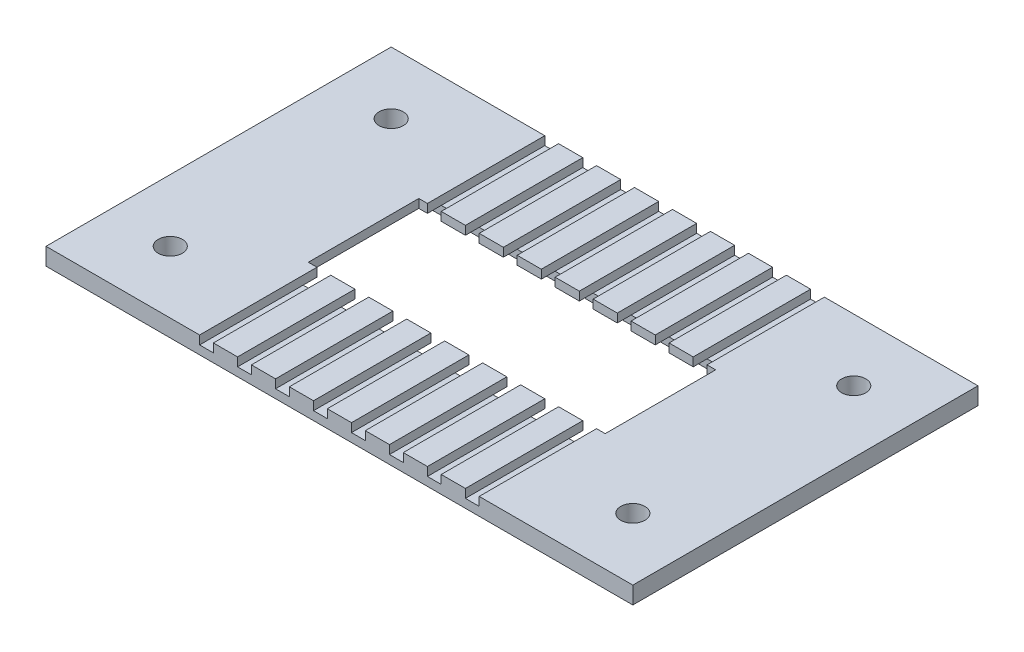
from build123d import *

# Parameters (mm, degrees)
SKETCH1_W           = 85
SKETCH1_H           = 50
BASE_PLATE_DEPTH    = 2.5
SKETCH7_R           = 1.75
SCRE_CUT_DEPTH      = 5
SKETCH13_W          = 43
SKETCH13_H          = 16
CUT_EXTRUDE1_DEPTH  = 10
SKETCH15_R          = 5
BOSS_EXTRUDE3_DEPTH = 4
SKETCH18_R          = 1.75
CUT_EXTRUDE4_DEPTH  = 4
M3_NUT_DEPTH        = 3
SKETCH21_W          = 47
SKETCH21_H          = 20
SKETCH21_W_2        = 43
SKETCH21_H_2        = 16
CUT_EXTRUDE7_DEPTH  = 1.25
CUT_EXTRUDE8_REACH  = 67.744
SKETCH20_W          = 2
SKETCH20_H          = 1.25


with BuildPart() as part:
    # Sketch1 → Base Plate (new body)
    with BuildSketch(Plane(origin=(0, 0, 0), x_dir=(1, 0, 0), z_dir=(0, 1, 0))):
        Rectangle(SKETCH1_W, SKETCH1_H)
    extrude(amount=BASE_PLATE_DEPTH)

    # Sketch7 → Scre Cut (cut)
    with BuildSketch(Plane(origin=(0, 2.5, 0), x_dir=(1, 0, 0), z_dir=(0, 1, 0))):
        with Locations(Location((-33.5, 16, 0), (0, 0, 270))):
            Circle(SKETCH7_R)
        with Locations(Location((-33.5, -16, 0), (0, 0, 270))):
            Circle(SKETCH7_R)
        with Locations(Location((33.5, -16, 0), (0, 0, 270))):
            Circle(SKETCH7_R)
        with Locations(Location((33.5, 16, 0), (0, 0, 270))):
            Circle(SKETCH7_R)
    extrude(amount=-SCRE_CUT_DEPTH, mode=Mode.SUBTRACT)

    # Sketch13 → Cut-Extrude1 (cut)
    with BuildSketch(Plane(origin=(0, 2.5, 0), x_dir=(1, 0, 0), z_dir=(0, 1, 0))):
        Rectangle(SKETCH13_W, SKETCH13_H)
    extrude(amount=-CUT_EXTRUDE1_DEPTH, mode=Mode.SUBTRACT)

    # Sketch15 → Boss-Extrude3 (add)
    with BuildSketch(Plane(origin=(-42.5, 0, -25), x_dir=(1, 0, 0), z_dir=(0, -1, 0))):
        with Locations(Location((9, 9, 0), (0, 0, 90))):
            Circle(SKETCH15_R)
        with Locations(Location((9, 41, 0), (0, 0, 90))):
            Circle(SKETCH15_R)
        with Locations(Location((76, 41, 0), (0, 0, 90))):
            Circle(SKETCH15_R)
        with Locations(Location((76, 9, 0), (0, 0, 90))):
            Circle(SKETCH15_R)
    extrude(amount=BOSS_EXTRUDE3_DEPTH)

    # Sketch18 → Cut-Extrude4 (cut)
    with BuildSketch(Plane(origin=(0, 0, 0), x_dir=(1, 0, 0), z_dir=(0, 1, 0))):
        with Locations(Location((-33.5, 16, 0), (0, 0, 270))):
            Circle(SKETCH18_R)
        with Locations(Location((-33.5, -16, 0), (0, 0, 90))):
            Circle(SKETCH18_R)
        with Locations(Location((33.5, 16, 0), (0, 0, 90))):
            Circle(SKETCH18_R)
        with Locations(Location((33.5, -16, 0), (0, 0, 270))):
            Circle(SKETCH18_R)
    extrude(amount=-CUT_EXTRUDE4_DEPTH, mode=Mode.SUBTRACT)

    # Sketch19 → M3 Nut (cut)
    with BuildSketch(Plane.XZ.offset(4)):
        Polygon((-33.5, -12.709103466), (-36.35, -14.354551733), (-36.35, -17.645448267), (-33.5, -19.290896534), (-30.65, -17.645448267), (-30.65, -14.354551733), align=None)
        Polygon((-30.65, 14.354551733), (-33.5, 12.709103466), (-36.35, 14.354551733), (-36.35, 17.645448267), (-33.5, 19.290896534), (-30.65, 17.645448267), align=None)
        Polygon((30.65, -14.354551733), (33.5, -12.709103466), (36.35, -14.354551733), (36.35, -17.645448267), (33.5, -19.290896534), (30.65, -17.645448267), align=None)
        Polygon((33.5, 12.709103466), (36.35, 14.354551733), (36.35, 17.645448267), (33.5, 19.290896534), (30.65, 17.645448267), (30.65, 14.354551733), align=None)
    extrude(amount=-M3_NUT_DEPTH, mode=Mode.SUBTRACT)

    # Sketch21 → Cut-Extrude7 (cut)
    with BuildSketch(Plane.XZ):
        Rectangle(SKETCH21_W, SKETCH21_H)
        Rectangle(SKETCH21_W_2, SKETCH21_H_2, mode=Mode.SUBTRACT)
    extrude(amount=-CUT_EXTRUDE7_DEPTH, mode=Mode.SUBTRACT)

    # Cut-Extrude8: up to this face of the body (flat: up to its plane)
    cut_extrude8_end = Plane(part.part.faces().sort_by_distance((0, 1.25, 25))[0])
    # Sketch20 → Cut-Extrude8 (cut, up to the picked face)
    with BuildSketch(Plane(origin=(0, 0, -25), x_dir=(-1, 0, 0), z_dir=(0, 0, -1)), mode=Mode.PRIVATE) as cut_extrude8_sk1:
        with Locations((-2.75, 1.875)):
            Rectangle(SKETCH20_W, SKETCH20_H)
    cut_extrude8_tool1 = split(extrude(cut_extrude8_sk1.sketch, amount=-CUT_EXTRUDE8_REACH, mode=Mode.PRIVATE), bisect_by=cut_extrude8_end, keep=Keep.BOTH, mode=Mode.PRIVATE)
    # Sketch20 → Cut-Extrude8 (cut, up to the picked face)
    with BuildSketch(Plane(origin=(0, 0, -25), x_dir=(-1, 0, 0), z_dir=(0, 0, -1)), mode=Mode.PRIVATE) as cut_extrude8_sk2:
        with Locations((-8.25, 1.875)):
            Rectangle(SKETCH20_W, SKETCH20_H)
    cut_extrude8_tool2 = split(extrude(cut_extrude8_sk2.sketch, amount=-CUT_EXTRUDE8_REACH, mode=Mode.PRIVATE), bisect_by=cut_extrude8_end, keep=Keep.BOTH, mode=Mode.PRIVATE)
    # Sketch20 → Cut-Extrude8 (cut, up to the picked face)
    with BuildSketch(Plane(origin=(0, 0, -25), x_dir=(-1, 0, 0), z_dir=(0, 0, -1)), mode=Mode.PRIVATE) as cut_extrude8_sk3:
        with Locations((-13.75, 1.875)):
            Rectangle(SKETCH20_W, SKETCH20_H)
    cut_extrude8_tool3 = split(extrude(cut_extrude8_sk3.sketch, amount=-CUT_EXTRUDE8_REACH, mode=Mode.PRIVATE), bisect_by=cut_extrude8_end, keep=Keep.BOTH, mode=Mode.PRIVATE)
    # Sketch20 → Cut-Extrude8 (cut, up to the picked face)
    with BuildSketch(Plane(origin=(0, 0, -25), x_dir=(-1, 0, 0), z_dir=(0, 0, -1)), mode=Mode.PRIVATE) as cut_extrude8_sk4:
        with Locations((-19.25, 1.875)):
            Rectangle(SKETCH20_W, SKETCH20_H)
    cut_extrude8_tool4 = split(extrude(cut_extrude8_sk4.sketch, amount=-CUT_EXTRUDE8_REACH, mode=Mode.PRIVATE), bisect_by=cut_extrude8_end, keep=Keep.BOTH, mode=Mode.PRIVATE)
    # Sketch20 → Cut-Extrude8 (cut, up to the picked face)
    with BuildSketch(Plane(origin=(0, 0, -25), x_dir=(-1, 0, 0), z_dir=(0, 0, -1)), mode=Mode.PRIVATE) as cut_extrude8_sk5:
        with Locations((19.25, 1.875)):
            Rectangle(SKETCH20_W, SKETCH20_H)
    cut_extrude8_tool5 = split(extrude(cut_extrude8_sk5.sketch, amount=-CUT_EXTRUDE8_REACH, mode=Mode.PRIVATE), bisect_by=cut_extrude8_end, keep=Keep.BOTH, mode=Mode.PRIVATE)
    # Sketch20 → Cut-Extrude8 (cut, up to the picked face)
    with BuildSketch(Plane(origin=(0, 0, -25), x_dir=(-1, 0, 0), z_dir=(0, 0, -1)), mode=Mode.PRIVATE) as cut_extrude8_sk6:
        with Locations((13.75, 1.875)):
            Rectangle(SKETCH20_W, SKETCH20_H)
    cut_extrude8_tool6 = split(extrude(cut_extrude8_sk6.sketch, amount=-CUT_EXTRUDE8_REACH, mode=Mode.PRIVATE), bisect_by=cut_extrude8_end, keep=Keep.BOTH, mode=Mode.PRIVATE)
    # Sketch20 → Cut-Extrude8 (cut, up to the picked face)
    with BuildSketch(Plane(origin=(0, 0, -25), x_dir=(-1, 0, 0), z_dir=(0, 0, -1)), mode=Mode.PRIVATE) as cut_extrude8_sk7:
        with Locations((8.25, 1.875)):
            Rectangle(SKETCH20_W, SKETCH20_H)
    cut_extrude8_tool7 = split(extrude(cut_extrude8_sk7.sketch, amount=-CUT_EXTRUDE8_REACH, mode=Mode.PRIVATE), bisect_by=cut_extrude8_end, keep=Keep.BOTH, mode=Mode.PRIVATE)
    # Sketch20 → Cut-Extrude8 (cut, up to the picked face)
    with BuildSketch(Plane(origin=(0, 0, -25), x_dir=(-1, 0, 0), z_dir=(0, 0, -1)), mode=Mode.PRIVATE) as cut_extrude8_sk8:
        with Locations((2.75, 1.875)):
            Rectangle(SKETCH20_W, SKETCH20_H)
    cut_extrude8_tool8 = split(extrude(cut_extrude8_sk8.sketch, amount=-CUT_EXTRUDE8_REACH, mode=Mode.PRIVATE), bisect_by=cut_extrude8_end, keep=Keep.BOTH, mode=Mode.PRIVATE)
    add(cut_extrude8_tool1.solids().sort_by(Axis((2.75, 1.875, -25), (0, 0, 1)))[0], mode=Mode.SUBTRACT)
    add(cut_extrude8_tool2.solids().sort_by(Axis((8.25, 1.875, -25), (0, 0, 1)))[0], mode=Mode.SUBTRACT)
    add(cut_extrude8_tool3.solids().sort_by(Axis((13.75, 1.875, -25), (0, 0, 1)))[0], mode=Mode.SUBTRACT)
    add(cut_extrude8_tool4.solids().sort_by(Axis((19.25, 1.875, -25), (0, 0, 1)))[0], mode=Mode.SUBTRACT)
    add(cut_extrude8_tool5.solids().sort_by(Axis((-19.25, 1.875, -25), (0, 0, 1)))[0], mode=Mode.SUBTRACT)
    add(cut_extrude8_tool6.solids().sort_by(Axis((-13.75, 1.875, -25), (0, 0, 1)))[0], mode=Mode.SUBTRACT)
    add(cut_extrude8_tool7.solids().sort_by(Axis((-8.25, 1.875, -25), (0, 0, 1)))[0], mode=Mode.SUBTRACT)
    add(cut_extrude8_tool8.solids().sort_by(Axis((-2.75, 1.875, -25), (0, 0, 1)))[0], mode=Mode.SUBTRACT)


solid = part.part
